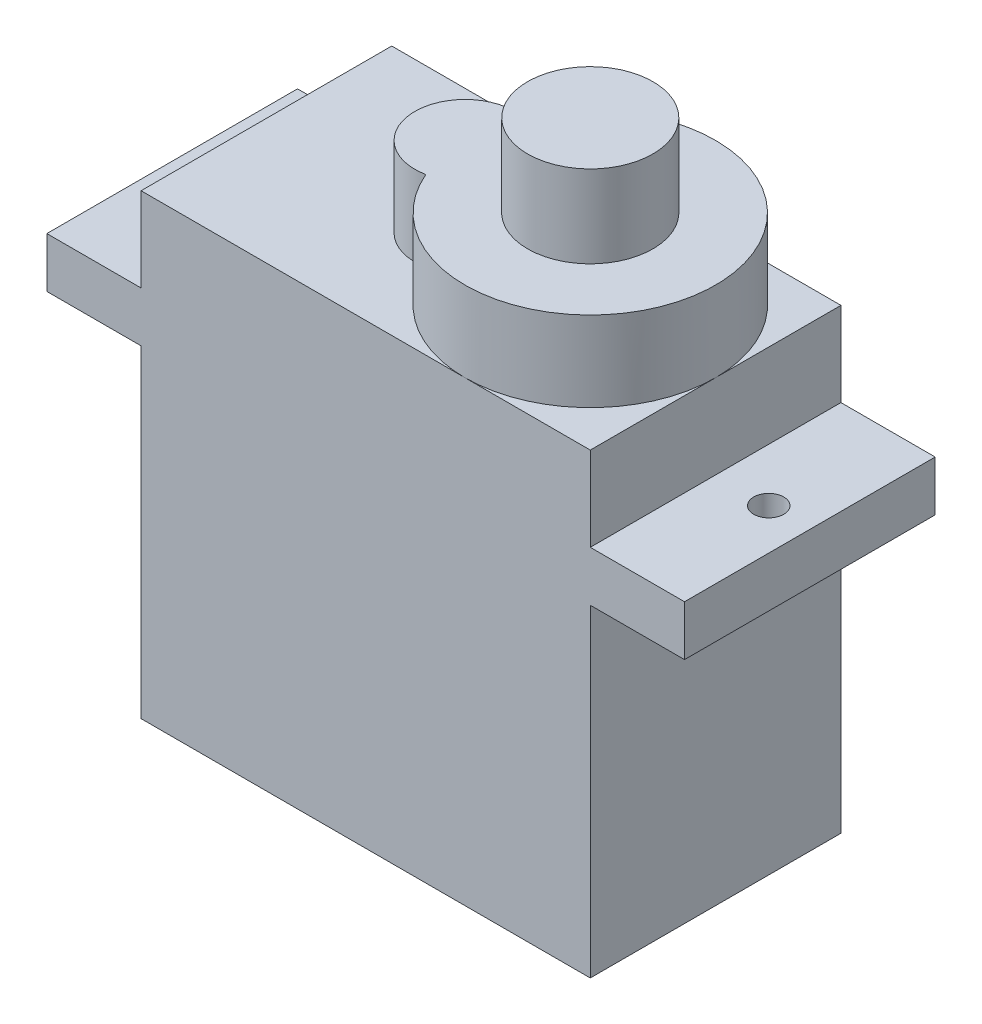
from build123d import *

# Parameters (mm, degrees)
SKETCH_1_W          = 22.4
SKETCH_1_H          = 12.5
EXTRUDE_1_DEPTH     = 22.8
EXTRUDE_START       = 16.1
SKETCH_2_W          = 31.8
SKETCH_2_H          = 12.5
EXTRUDE_2_DEPTH     = 2.5
CUT_EXTRUDE_1_REACH = 27.255
SKETCH_3_R          = 0.75
EXTRUDE_3_DEPTH     = 4
SKETCH_6_R          = 3.125
EXTRUDE_4_DEPTH     = 4.1


with BuildPart() as part:
    # 草图1 → 凸台-拉伸1 (new body)
    with BuildSketch(Plane(origin=(0, 0, 0), x_dir=(1, 0, 0), z_dir=(0, 1, 0))):
        Rectangle(SKETCH_1_W, SKETCH_1_H)
    extrude(amount=EXTRUDE_1_DEPTH)

    # 草图2 → 凸台-拉伸2 (add)
    with BuildSketch(Plane(origin=(0, 0, 0), x_dir=(1, 0, 0), z_dir=(0, 1, 0)).offset(EXTRUDE_START)):
        Rectangle(SKETCH_2_W, SKETCH_2_H)
    extrude(amount=EXTRUDE_2_DEPTH)

    # 草图3 → 切除-拉伸1 (cut, up to next)
    with BuildSketch(Plane(origin=(0, 18.6, 0), x_dir=(1, 0, 0), z_dir=(0, 1, 0)), mode=Mode.PRIVATE) as cut_extrude_1_sk1:
        with Locations(Location((-13.85, 0, 0), (0, 0, 270))):
            Circle(SKETCH_3_R)
    cut_extrude_1_tool1 = extrude(cut_extrude_1_sk1.sketch, amount=-CUT_EXTRUDE_1_REACH, mode=Mode.PRIVATE) & part.part
    # 草图3 → 切除-拉伸1 (cut, up to next)
    with BuildSketch(Plane(origin=(0, 18.6, 0), x_dir=(1, 0, 0), z_dir=(0, 1, 0)), mode=Mode.PRIVATE) as cut_extrude_1_sk2:
        with Locations(Location((13.85, 0, 0), (0, 0, 270))):
            Circle(SKETCH_3_R)
    cut_extrude_1_tool2 = extrude(cut_extrude_1_sk2.sketch, amount=-CUT_EXTRUDE_1_REACH, mode=Mode.PRIVATE) & part.part
    add(cut_extrude_1_tool1.solids().sort_by_distance((-13.85, 18.6, 0))[0], mode=Mode.SUBTRACT)
    add(cut_extrude_1_tool2.solids().sort_by_distance((13.85, 18.6, 0))[0], mode=Mode.SUBTRACT)

    # 草图4 → 凸台-拉伸3 (add)
    with BuildSketch(Plane(origin=(0, 22.8, 0), x_dir=(1, 0, 0), z_dir=(0, 1, 0))):
        with BuildLine():
            ThreePointArc((-0.8, -2.449489743), (11.2, 0), (-0.8, 2.449489743))
            ThreePointArc((-0.8, 2.449489743), (-3.8, 0), (-0.8, -2.449489743))
        make_face()
    extrude(amount=EXTRUDE_3_DEPTH)

    # 草图6 → 凸台-拉伸4 (add)
    with BuildSketch(Plane(origin=(0, 26.8, 0), x_dir=(1, 0, 0), z_dir=(0, 1, 0))):
        with Locations(Location((4.95, 0, 0), (0, 0, 270))):
            Circle(SKETCH_6_R)
    extrude(amount=EXTRUDE_4_DEPTH)


solid = part.part
